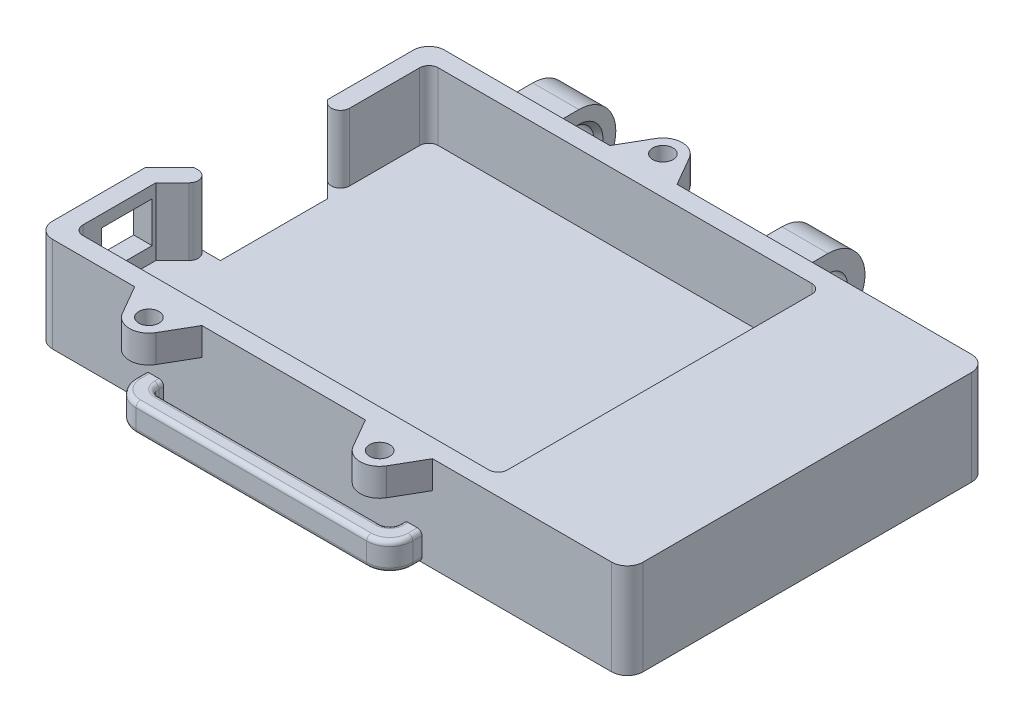
from build123d import *

# Parameters (mm, degrees)
SKETCH1_W               = 50
SKETCH1_H               = 39
BOSS_EXTRUDE1_DEPTH     = 3
BOSS_EXTRUDE2_START     = 3
SKETCH1_4_W             = 2
SKETCH1_4_H             = 2
SKETCH1_4_W_2           = 46
SKETCH1_4_H_2           = 35
BOSS_EXTRUDE2_DEPTH     = 7.3
BOSS_EXTRUDE3_START     = 10.3
SKETCH1_5_W             = 50
SKETCH1_5_H             = 39
BOSS_EXTRUDE3_DEPTH     = 3
CUT_EXTRUDE5_DEPTH      = 63.047481818
CUT_EXTRUDE5_DEPTH_BACK = 63.047481818
BOSS_EXTRUDE4_REACH     = 64.047
CUT_EXTRUDE2_REACH      = 65.607
SKETCH2_W               = 5.5
SKETCH2_H               = 4.4
SKETCH8_R               = 1.1
BOSS_EXTRUDE5_DEPTH     = 6
FILLET1_R               = 1.7
FILLET10_R              = 1
BOSS_EXTRUDE8_DEPTH     = 3
FILLET5_R               = 0.5
BOSS_EXTRUDE11_START    = 11
SKETCH13_R              = 2.1
BOSS_EXTRUDE11_DEPTH    = 5
CHAMFER1_SIZE           = 0.5
CUT_EXTRUDE9_DEPTH      = 67.19886706
CUT_EXTRUDE9_DEPTH_BACK = 67.19886706
SKETCH29_R              = 1.3
FILLET12_R              = 1
BOSS_EXTRUDE23_DEPTH    = 10.3


with BuildPart() as part:
    # Sketch1 → Boss-Extrude1 (new body)
    with BuildSketch(Plane(origin=(0, 0, 0), x_dir=(1, 0, 0), z_dir=(0, 1, 0))):
        with Locations((23, 17.5)):
            Rectangle(SKETCH1_W, SKETCH1_H)
    extrude(amount=BOSS_EXTRUDE1_DEPTH)

    # Sketch1<4> → Boss-Extrude2 (add)
    with BuildSketch(Plane(origin=(0, 0, 0), x_dir=(1, 0, 0), z_dir=(0, 1, 0)).offset(BOSS_EXTRUDE2_START)):
        with Locations((-1, 36)):
            Rectangle(SKETCH1_4_W, SKETCH1_4_H)
        with Locations((23, 36)):
            Rectangle(SKETCH1_4_W_2, SKETCH1_4_H)
        with Locations((-1, 17.5)):
            Rectangle(SKETCH1_4_W, SKETCH1_4_H_2)
        with Locations((47, 36)):
            Rectangle(SKETCH1_4_W, SKETCH1_4_H)
        with Locations((47, 17.5)):
            Rectangle(SKETCH1_4_W, SKETCH1_4_H_2)
        with Locations((23, -1)):
            Rectangle(SKETCH1_4_W_2, SKETCH1_4_H)
        with Locations((47, -1)):
            Rectangle(SKETCH1_4_W, SKETCH1_4_H)
        with Locations((-1, -1)):
            Rectangle(SKETCH1_4_W, SKETCH1_4_H)
    extrude(amount=BOSS_EXTRUDE2_DEPTH)

    # Sketch1<5> → Boss-Extrude3 (add)
    with BuildSketch(Plane(origin=(0, 0, 0), x_dir=(1, 0, 0), z_dir=(0, 1, 0)).offset(BOSS_EXTRUDE3_START)):
        with Locations((23, 17.5)):
            Rectangle(SKETCH1_5_W, SKETCH1_5_H)
    extrude(amount=BOSS_EXTRUDE3_DEPTH)

    # Sketch5 → Cut-Extrude5 (cut, two sides: drawn at the far end of the back side and taken through both)
    with BuildSketch(Plane(origin=(0, 13.3, 0), x_dir=(1, 0, 0), z_dir=(0, 1, 0)).offset(-CUT_EXTRUDE5_DEPTH_BACK)):
        Polygon((3.5, 12.4), (-2, 6.9), (-2, 37), (3.5, 37), align=None)
    extrude(amount=CUT_EXTRUDE5_DEPTH + CUT_EXTRUDE5_DEPTH_BACK, mode=Mode.SUBTRACT)

    # Boss-Extrude4: up to this face of the body (flat: up to its plane)
    boss_extrude4_end = Plane(part.part.faces().sort_by_distance((24.867563638, 0, -17.016945205))[0])
    # Sketch7 → Boss-Extrude4 (add, up to the picked face)
    with BuildSketch(Plane(origin=(0, 13.3, 0), x_dir=(1, 0, 0), z_dir=(0, 1, 0)), mode=Mode.PRIVATE) as boss_extrude4_sk1:
        Polygon((-2, 9.728427125), (-2, 6.9), (3.5, 12.4), (0.671572875, 12.4), align=None)
    boss_extrude4_tool1 = split(extrude(boss_extrude4_sk1.sketch, amount=-BOSS_EXTRUDE4_REACH, mode=Mode.PRIVATE), bisect_by=boss_extrude4_end, keep=Keep.BOTH, mode=Mode.PRIVATE)
    # Sketch7 → Boss-Extrude4 (add, up to the picked face)
    with BuildSketch(Plane(origin=(0, 13.3, 0), x_dir=(1, 0, 0), z_dir=(0, 1, 0)), mode=Mode.PRIVATE) as boss_extrude4_sk2:
        Polygon((1.5, 26), (3.5, 24), (3.5, 37), (1.5, 37), align=None)
    boss_extrude4_tool2 = split(extrude(boss_extrude4_sk2.sketch, amount=-BOSS_EXTRUDE4_REACH, mode=Mode.PRIVATE), bisect_by=boss_extrude4_end, keep=Keep.BOTH, mode=Mode.PRIVATE)
    add(boss_extrude4_tool1.solids().sort_by(Axis((0.124477, 13.3, -10.275523), (0, -1, 0)))[0])
    add(boss_extrude4_tool2.solids().sort_by(Axis((2.527778, 13.3, -30.986111), (0, -1, 0)))[0])

    # Sketch2 → Cut-Extrude2 (cut, up to next)
    with BuildSketch(Plane.ZY.offset(2), mode=Mode.PRIVATE) as cut_extrude2_sk1:
        with Locations((-5.75, 6.8)):
            Rectangle(SKETCH2_W, SKETCH2_H)
    cut_extrude2_tool1 = extrude(cut_extrude2_sk1.sketch, amount=-CUT_EXTRUDE2_REACH, mode=Mode.PRIVATE) & part.part
    add(cut_extrude2_tool1.solids().sort_by_distance((-2, 6.8, -5.75))[0], mode=Mode.SUBTRACT)

    # Sketch8 → Boss-Extrude5 (add)
    # profile 1 of 3: a face of its own
    with BuildSketch(Plane(origin=(0, 13.3, 0), x_dir=(1, 0, 0), z_dir=(0, 1, 0))):
        with BuildLine():
            Line((22.931346652, 40.15), (21.112693304, 37))
            Line((21.112693304, 37), (28.387306696, 37))
            Line((28.387306696, 37), (26.568653348, 40.15))
            ThreePointArc((26.568653348, 40.15), (24.75, 41.2), (22.931346652, 40.15))
        make_face()
        with Locations(Location((24.75, 39.1, 0), (0, 0, 270))):
            Circle(SKETCH8_R, mode=Mode.SUBTRACT)
    # profile 2 of 3: a face of its own
    with BuildSketch(Plane(origin=(0, 13.3, 0), x_dir=(1, 0, 0), z_dir=(0, 1, 0))):
        with BuildLine():
            Line((39.068653348, -5.15), (40.887306696, -2))
            Line((40.887306696, -2), (33.612693304, -2))
            Line((33.612693304, -2), (35.431346652, -5.15))
            ThreePointArc((35.431346652, -5.15), (37.25, -6.2), (39.068653348, -5.15))
        make_face()
        with Locations(Location((37.25, -4.1, 0), (0, 0, 270))):
            Circle(SKETCH8_R, mode=Mode.SUBTRACT)
    # profile 3 of 3: a face of its own
    with BuildSketch(Plane(origin=(0, 13.3, 0), x_dir=(1, 0, 0), z_dir=(0, 1, 0))):
        with BuildLine():
            Line((14.068653348, -5.15), (15.887306696, -2))
            Line((15.887306696, -2), (8.612693304, -2))
            Line((8.612693304, -2), (10.431346652, -5.15))
            ThreePointArc((10.431346652, -5.15), (12.25, -6.2), (14.068653348, -5.15))
        make_face()
        with Locations(Location((12.25, -4.1, 0), (0, 0, 270))):
            Circle(SKETCH8_R, mode=Mode.SUBTRACT)
    extrude(amount=-BOSS_EXTRUDE5_DEPTH)


with BuildPart() as body_2:
    # Split1: the piece on the far side of the plane
    add(part.part)
    split(bisect_by=Plane(origin=(0, 10.3, 0), x_dir=(0, 0, -1), z_dir=(0, -1, 0)), keep=Keep.BOTTOM)


with BuildPart() as part_1:
    add(part.part)

    # Split1
    split(bisect_by=Plane(origin=(0, 10.3, 0), x_dir=(0, 0, -1), z_dir=(0, -1, 0)), keep=Keep.TOP)

    # Fillet1
    fillet1_edges = [part_1.edges().sort_by_distance(p)[0] for p in [
        (48, 5.15, -37),
        (48, 5.15, 2),
        (-2, 5.15, 2),
        (1.5, 5.15, -37),
    ]]
    fillet(fillet1_edges, radius=FILLET1_R)

    # Fillet10
    fillet10_edges = [part_1.edges().sort_by_distance(p)[0] for p in [
        (0, 6.65, 0),
        (46, 6.65, 0),
        (46, 6.65, -35),
        (3.5, 6.65, -35),
    ]]
    fillet(fillet10_edges, radius=FILLET10_R)

    # Sketch13 → Boss-Extrude11 (add)
    with BuildSketch(Plane.ZY.offset(-24.75).offset(BOSS_EXTRUDE11_START)):
        with BuildLine():
            Line((-37, 0), (-37, 8))
            Line((-37, 8), (-41, 8))
            ThreePointArc((-41, 8), (-43.828427125, 6.828427125), (-45, 4))
            ThreePointArc((-45, 4), (-43.828427125, 1.171572875), (-41, 0))
            Line((-41, 0), (-37, 0))
        make_face()
        with Locations(Location((-41, 4, 0), (0, 0, 180))):
            Circle(SKETCH13_R, mode=Mode.SUBTRACT)
    boss_extrude11 = extrude(amount=BOSS_EXTRUDE11_DEPTH)

    # Mirror1: Boss-Extrude11 across plane
    add(boss_extrude11.mirror(Plane(origin=(24.75, 0, 0), x_dir=(0, 0, 1), z_dir=(1, 0, 0))))

    # Chamfer1
    chamfer1_edges = [part_1.edges().sort_by_distance(p)[0] for p in [
        (13.75, 4, -38.9),
        (35.75, 4, -38.9),
    ]]
    chamfer(chamfer1_edges, length=CHAMFER1_SIZE)

    # Sketch29 → Cut-Extrude9 (cut, two sides: drawn at the far end of the back side and taken through both)
    with BuildSketch(Plane(origin=(0, 3, 0), x_dir=(1, 0, 0), z_dir=(0, 1, 0)).offset(-CUT_EXTRUDE9_DEPTH_BACK)):
        with Locations(Location((39.5, 3.4, 0), (0, 0, 270))):
            Circle(SKETCH29_R)
    extrude(amount=CUT_EXTRUDE9_DEPTH + CUT_EXTRUDE9_DEPTH_BACK, mode=Mode.SUBTRACT)

    # Fillet12
    fillet12_edges = [part_1.edges().sort_by_distance(p)[0] for p in [
        (3.5, 6.65, -12.4),
        (3.5, 6.65, -24),
    ]]
    fillet(fillet12_edges, radius=FILLET12_R)

    # Sketch32 → Boss-Extrude23 (add)
    with BuildSketch(Plane(origin=(0, 0, 0), x_dir=(1, 0, 0), z_dir=(0, 1, 0))):
        with BuildLine():
            ThreePointArc((62, 35.3), (61.502081528, 36.502081528), (60.3, 37))
            Line((60.3, 37), (46.3, 37))
            ThreePointArc((46.3, 37), (47.502081528, 36.502081528), (48, 35.3))
            Line((48, 35.3), (48, -0.3))
            ThreePointArc((48, -0.3), (47.502081528, -1.502081528), (46.3, -2))
            Line((46.3, -2), (60.3, -2))
            ThreePointArc((60.3, -2), (61.502081528, -1.502081528), (62, -0.3))
            Line((62, -0.3), (62, 35.3))
        make_face()
    extrude(amount=BOSS_EXTRUDE23_DEPTH)


with BuildPart() as body_2_2:
    # Sketch11 → Boss-Extrude8 (new body)
    with BuildSketch(Plane.XZ):
        with BuildLine():
            Line((39.75, 2), (39.75, 3))
            ThreePointArc((39.75, 3), (39.017766953, 4.767766953), (37.25, 5.5))
            Line((37.25, 5.5), (12.25, 5.5))
            ThreePointArc((12.25, 5.5), (10.482233047, 4.767766953), (9.75, 3))
            Line((9.75, 3), (9.75, 2))
            Line((9.75, 2), (11.75, 2))
            Line((11.75, 2), (11.75, 2.5))
            ThreePointArc((11.75, 2.5), (12.042893219, 3.207106781), (12.75, 3.5))
            Line((12.75, 3.5), (36.75, 3.5))
            ThreePointArc((36.75, 3.5), (37.457106781, 3.207106781), (37.75, 2.5))
            Line((37.75, 2.5), (37.75, 2))
            Line((37.75, 2), (39.75, 2))
        make_face()
    extrude(amount=-BOSS_EXTRUDE8_DEPTH)

    # Fillet5
    fillet5_edges = [body_2_2.edges().sort_by_distance(p)[0] for p in [
        (37.75, 0, 2.25),
        (37.457106781, 0, 3.207106781),
        (39.017766953, 3, 4.767766953),
        (24.75, 0, 3.5),
        (12.042893219, 0, 3.207106781),
        (11.75, 0, 2.25),
        (9.75, 0, 2.5),
        (10.482233047, 0, 4.767766953),
        (24.75, 0, 5.5),
        (39.017766953, 0, 4.767766953),
        (39.75, 0, 2.5),
        (24.75, 3, 5.5),
        (10.482233047, 3, 4.767766953),
        (9.75, 3, 2.5),
        (11.75, 3, 2.25),
        (12.042893219, 3, 3.207106781),
        (24.75, 3, 3.5),
        (37.457106781, 3, 3.207106781),
        (37.75, 3, 2.25),
        (39.75, 3, 2.5),
    ]]
    fillet(fillet5_edges, radius=FILLET5_R)


solid = Compound([part_1.part, body_2_2.part])
